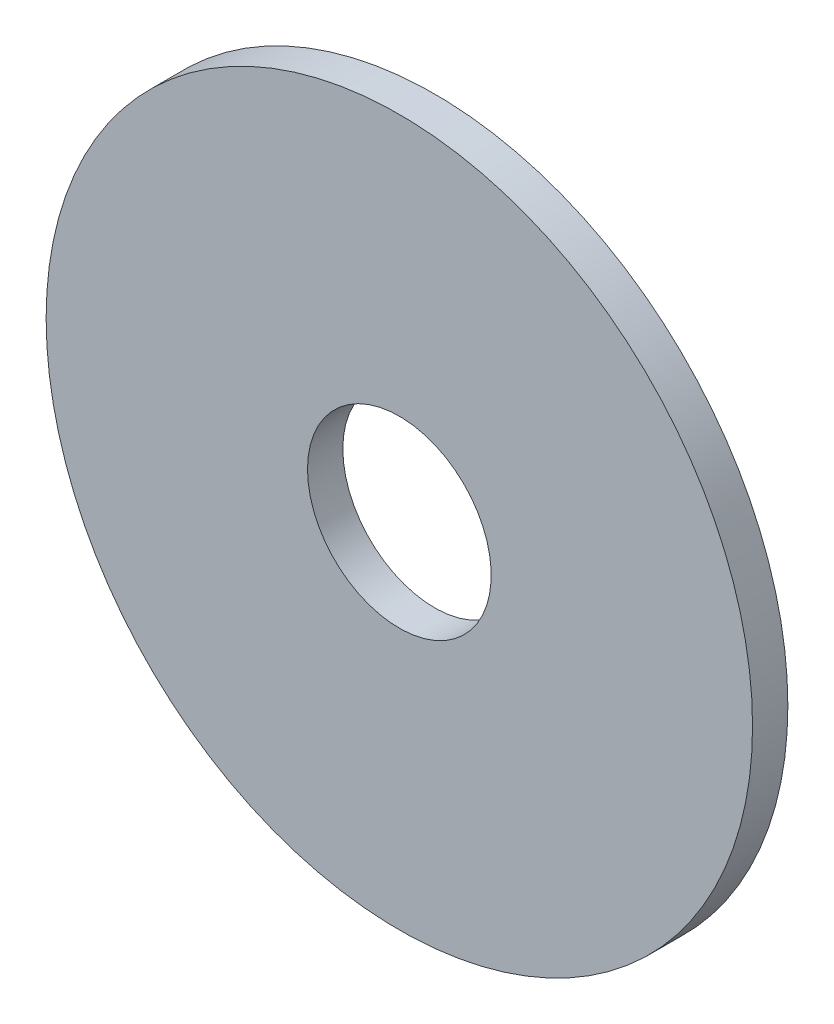
from build123d import *

# Parameters (mm, degrees)
SKETCH1_W = 7.4
SKETCH1_H = 1


with BuildPart() as part:
    # Sketch1 → Revolve1 (revolve)
    with BuildSketch(Plane.XZ, mode=Mode.PRIVATE) as revolve1_sk:
        with Locations((6.3, 0.5)):
            Rectangle(SKETCH1_W, SKETCH1_H)
    revolve(revolve1_sk.sketch.rotate(Axis((0, 0, 1), (0, 0, -1)), 180), axis=Axis((0, 0, 1), (0, 0, -1)))


solid = part.part
